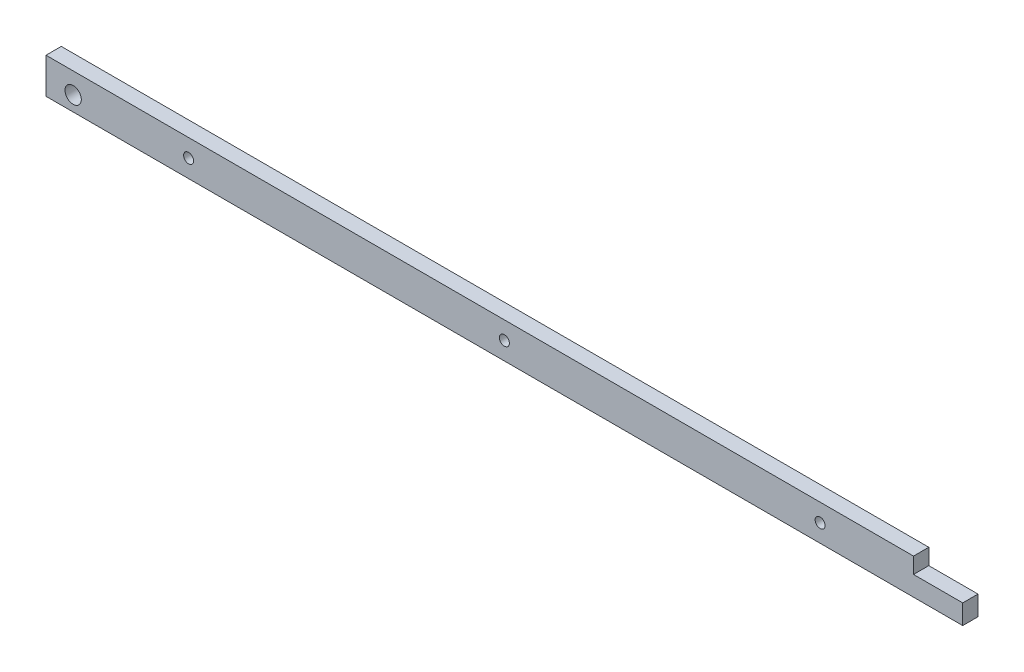
from build123d import *

# Parameters (mm, degrees)
SKETCH1_R           = 2.4892
SKETCH1_R_2         = 4.0635
BOSS_EXTRUDE1_DEPTH = 7.62


with BuildPart() as part:
    # Sketch1 → Boss-Extrude1 (new body)
    with BuildSketch(Plane.XY):
        Polygon((0, 12.964410589), (432.660000058, 12.964410589), (432.660000058, 5.019410589), (457.2, 5.019410589), (457.2, -4.800589411), (0, -4.800589411), align=None)
        with Locations(Location((386.08, 4.081910589, 0), (0, 0, 180))):
            Circle(SKETCH1_R, mode=Mode.SUBTRACT)
        with Locations(Location((228.6, 4.081910589, 0), (0, 0, 180))):
            Circle(SKETCH1_R, mode=Mode.SUBTRACT)
        with Locations(Location((71.12, 4.081910589, 0), (0, 0, 180))):
            Circle(SKETCH1_R, mode=Mode.SUBTRACT)
        with Locations(Location((13.54, 2.599410589, 0), (0, 0, 180))):
            Circle(SKETCH1_R_2, mode=Mode.SUBTRACT)
    extrude(amount=BOSS_EXTRUDE1_DEPTH)


solid = part.part
